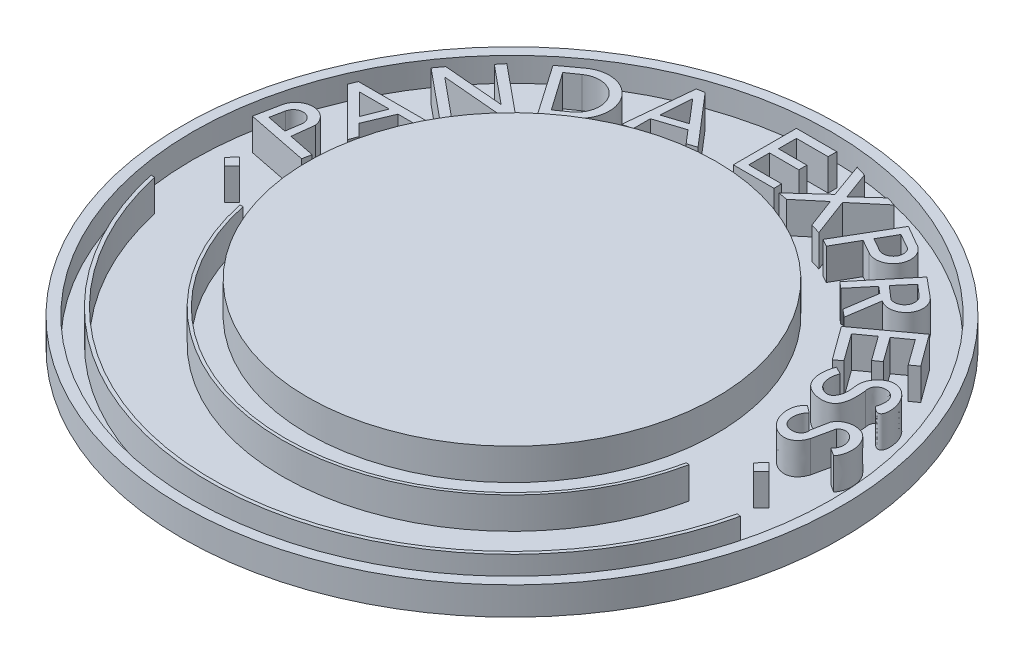
from build123d import *

# Parameters (mm, degrees)
SKETCH1_R           = 470.625097544
BOSS_EXTRUDE1_DEPTH = 40
CUT_EXTRUDE11_DEPTH = 25
SKETCH6_R           = 291.687541018
BOSS_EXTRUDE3_DEPTH = 45
SKETCH3_R           = 455.620261144
CUT_EXTRUDE2_DEPTH  = 34.62586797
BOSS_EXTRUDE2_DEPTH = 45


with BuildPart() as part:
    # Sketch1 → Boss-Extrude1 (new body)
    with BuildSketch(Plane(origin=(0, 0, 0), x_dir=(1, 0, 0), z_dir=(0, 1, 0))):
        with Locations(Location((0, 0, 0), (0, 0, 270))):
            Circle(SKETCH1_R)
    extrude(amount=BOSS_EXTRUDE1_DEPTH)

    # Sketch8 → Cut-Extrude11 (cut)
    with BuildSketch(Plane(origin=(0, 40, 0), x_dir=(1, 0, 0), z_dir=(0, 1, 0))):
        with BuildLine():
            add(Edge.make_bspline(
                [(-78.092140064, 180.367039615), (-37.088949883, 192.930885504), (-27.979018092, 201.559779116), (36.742104268, 189.950344156), (41.135480759, 188.522470723), (53.659176355, 176.974528823), (58.917918381, 200.465799047), (75.235401346, 202.388042437), (92.103608284, 205.785797647), (117.460180506, 198.945598189), (132.709036111, 176.253001871), (136.572625824, 156.407771568), (128.802366777, 146.149977736), (135.129652293, 141.98557315), (142.261858959, 135.998040445), (163.402615615, 120.484001713), (178.385442315, 104.071141637), (187.697573089, 89.753175202)],
                knots=[0, 0, 0, 0, 0.408914969, 0.446675587, 0.508431617, 0.521002502, 0.564664928, 0.590555136, 0.63116015, 0.681704712, 0.759020832, 0.80183971, 0.817986516, 0.824477412, 0.847950703, 0.884939571, 1, 1, 1, 1], degree=3))
            add(Edge.make_bspline(
                [(187.697573089, 89.753175202), (201.099130024, 73.635190326), (214.371449052, 50.800864957), (229.927138351, 14.906730736), (233.346226634, -14.610997758), (237.779523432, -62.132556941), (230.021359328, -113.77085296), (170.286447424, -178.51521243), (163.230608693, -160.639748503), (151.434876437, -167.474977403), (151.342019812, -178.571962074), (127.475859417, -198.76425843), (153.142307727, -183.331644513), (121.788929367, -210.174427182), (109.443412622, -220.52420196), (80.16913494, -238.437317437), (45.484749508, -248.630935843), (6.862212411, -248.824311869), (-22.397397864, -226.084987266), (-16.276789205, -198.970307853), (2.907216752, -185.543365873), (20.394455857, -162.508790923), (14.766760153, -129.91167007), (-9.057903263, -120.264817108), (-27.84229809, -121.325923382), (-43.839572583, -132.48302391), (-45.520267909, -149.212449948), (-42.975488553, -165.426003074), (-34.155582099, -180.192192277), (-29.338404778, -198.455273756), (-37.161950648, -221.93128079), (-65.658348891, -228.704413738), (-89.953472852, -220.668413177), (-113.371010565, -206.962502009), (-139.716682722, -183.576694746), (-165.108083304, -153.951184024), (-176.161908153, -114.864131918), (-181.578902965, -78.640106222), (-163.75479192, -28.540680127), (-155.343750009, -8.944260686), (-147.6978369, -6.159121549), (-153.056135591, 8.047048225), (-156.73138928, 20.821907596), (-161.72069507, 36.270128689), (-162.17356316, 58.570860299), (-159.86983732, 79.885300963), (-154.780606114, 97.632642929), (-146.298983101, 109.738709404), (-158.046013992, 118.438690999), (-167.19191405, 128.732794193), (-175.602670702, 147.605468296), (-180.147723304, 167.248312546), (-175.991101143, 186.387567042), (-164.002258877, 201.58320857), (-149.760259049, 211.877640928), (-133.73114126, 214.228102413), (-119.98120751, 215.656115447), (-98.803179263, 204.035068087), (-85.935357669, 190.941745077), (-78.092140064, 180.367039615)],
                knots=[0, 0, 0, 0, 0.000844039, 0.00106524, 0.001578705, 0.002025756, 0.003033238, 0.003439662, 0.005795513, 0.006183959, 0.006935679, 0.007485411, 0.011587306, 0.018429778, 0.025739133, 0.035794512, 0.04930888, 0.06245737, 0.073551933, 0.079975077, 0.086853545, 0.096500506, 0.107782102, 0.113287322, 0.120717281, 0.125951305, 0.131086713, 0.136401964, 0.142263494, 0.148033398, 0.154919652, 0.164335827, 0.173351472, 0.180326741, 0.191259015, 0.208518184, 0.218341553, 0.230862457, 0.247485129, 0.255896646, 0.314977619, 0.331296116, 0.360678818, 0.398702127, 0.435770802, 0.503678201, 0.532486314, 0.562211983, 0.575847682, 0.616946904, 0.653699089, 0.706744711, 0.744635728, 0.774818762, 0.830303046, 0.851583335, 0.87897372, 0.917276909, 1, 1, 1, 1], degree=3))
        make_face()
    extrude(amount=-CUT_EXTRUDE11_DEPTH, mode=Mode.SUBTRACT)

    # Sketch6 → Boss-Extrude3 (add)
    with BuildSketch(Plane(origin=(0, 40, 0), x_dir=(1, 0, 0), z_dir=(0, 1, 0))):
        with Locations(Location((0, 0, 0), (0, 0, 90))):
            Circle(SKETCH6_R)
    extrude(amount=BOSS_EXTRUDE3_DEPTH)

    # Sketch3 → Cut-Extrude2 (cut)
    with BuildSketch(Plane(origin=(0, 40, 0), x_dir=(1, 0, 0), z_dir=(0, 1, 0))):
        with Locations(Location((0, 0, 0), (0, 0, 270))):
            Circle(SKETCH3_R)
    extrude(amount=-CUT_EXTRUDE2_DEPTH, mode=Mode.SUBTRACT)


with BuildPart() as cut_extrude2_piece_1:
    # of the separate pieces the step leaves, piece 1, a body of its own (cut_extrude2_pieces)
    add(part.part.solids().sort_by_distance((0, 40, -291.687541018))[0])


with BuildPart() as cut_extrude2_piece_2:
    # of the separate pieces the step leaves, piece 2, a body of its own (cut_extrude2_pieces)
    add(part.part.solids().sort_by_distance((0, 0, 470.625097544))[0])

    # Sketch4 → Boss-Extrude2 (add)
    # profile 1 of 16: a face of its own
    with BuildSketch(Plane(origin=(0, 5.37413203, 0), x_dir=(1, 0, 0), z_dir=(0, 1, 0))):
        Polygon((364.46284673, -19.84101692), (375.298774156, -8.52005088), (386.377220889, -19.598497614), (375.298774156, -30.676944347), align=None)
    # profile 2 of 16: a face of its own
    with BuildSketch(Plane(origin=(0, 5.37413203, 0), x_dir=(1, 0, 0), z_dir=(0, 1, 0))):
        with BuildLine():
            Line((-321.07332375, -67.355183159), (-316.727724187, -67.355183159))
            ThreePointArc((-316.727724187, -67.355183159), (0, -323.810395088), (316.727724187, -67.355183159))
            Line((316.727724187, -67.355183159), (320.886519161, -68.23959073))
            ThreePointArc((320.886519161, -68.23959073), (-0.45196037, -328.061877782), (-321.07332375, -67.355183159))
        make_face()
    # profile 3 of 16: a face of its own
    with BuildSketch(Plane(origin=(0, 5.37413203, 0), x_dir=(1, 0, 0), z_dir=(0, 1, 0))):
        with BuildLine():
            Line((416.227536422, -94.099439286), (421.202079266, -95.224068609))
            ThreePointArc((421.202079266, -95.224068609), (-0.576332378, -431.831544311), (-421.454754804, -94.099439286))
            Line((-421.454754804, -94.099439286), (-416.227536422, -94.099439286))
            ThreePointArc((-416.227536422, -94.099439286), (0, -426.731843844), (416.227536422, -94.099439286))
        make_face()
    # profile 4 of 16: a face of its own
    with BuildSketch(Plane(origin=(0, 5.37413203, 0), x_dir=(1, 0, 0), z_dir=(0, 1, 0))):
        with BuildLine():
            Line((401.417594673, 53.805674327), (413.103498964, 46.252744817))
            add(Edge.make_bspline(
                [(369.192828292, 85.210608043), (372.507703433, 92.739903712), (385.734880489, 100.135409316), (419.151518146, 94.177927522), (423.99688382, 59.67217761), (413.103498964, 46.252744817)],
                knots=[0, 0, 0, 0, 0.250574055, 0.443565275, 1, 1, 1, 1], degree=3))
            Line((369.192828292, 85.210608043), (364.46284673, 61.543278313))
            add(Edge.make_bspline(
                [(342.937591476, 81.4837119), (334.281350302, 75.395136283), (331.75139394, 41.827476902), (366.943374028, 47.040768514), (364.46284673, 61.543278313)],
                knots=[0, 0, 0, 0, 0.511771913, 1, 1, 1, 1], degree=3))
            Line((342.937591476, 81.4837119), (332.139568512, 89.753175202))
            add(Edge.make_bspline(
                [(332.139568512, 89.753175202), (319.951039406, 80.132186398), (323.353695305, 34.868950379), (367.290114743, 26.278585323), (375.298774156, 51.194303697)],
                knots=[0, 0, 0, 0, 0.459951469, 1, 1, 1, 1], degree=3))
            Line((375.298774156, 51.194303697), (381.910198575, 81.4837119))
            add(Edge.make_bspline(
                [(401.417594673, 53.805674327), (407.813665599, 58.67553153), (410.186729671, 78.278695648), (390.589542215, 90.386805381), (381.910198575, 81.4837119)],
                knots=[0, 0, 0, 0, 0.438729849, 1, 1, 1, 1], degree=3))
        make_face()
    # profile 5 of 16: a face of its own
    with BuildSketch(Plane(origin=(0, 5.37413203, 0), x_dir=(1, 0, 0), z_dir=(0, 1, 0))):
        with BuildLine():
            Line((305.532462516, 157.939250384), (316.491893802, 152.178907711))
            add(Edge.make_bspline(
                [(316.491893802, 152.178907711), (312.341383114, 142.769908485), (313.252459519, 122.725029525), (336.771460182, 115.4010574), (347.114905436, 135.165474652), (336.947676231, 157.728398221), (363.762646489, 188.170371347), (403.075350403, 163.870198528), (398.594568684, 119.589161451), (381.910198575, 137.216210342)],
                knots=[0, 0, 0, 0, 0.168105409, 0.236644245, 0.306997887, 0.450025045, 0.594025801, 0.792720453, 1, 1, 1, 1], degree=3))
            add(Edge.make_bspline(
                [(355.464500901, 149.395150061), (352.074205994, 163.176346162), (370.422142891, 169.956145396), (385.93965957, 155.405708664), (383.967523737, 143.329850159), (381.910198575, 137.216210342)],
                knots=[0, 0, 0, 0, 0.494708933, 0.645783631, 1, 1, 1, 1], degree=3))
            add(Edge.make_bspline(
                [(355.464500901, 149.395150061), (356.691076667, 137.605067508), (359.015513992, 100.665387814), (298.524412727, 110.129056114), (300.652881804, 145.047583234), (305.532462516, 157.939250384)],
                knots=[0, 0, 0, 0, 0.323017416, 0.634298948, 1, 1, 1, 1], degree=3))
        make_face()
    # profile 6 of 16: a face of its own
    with BuildSketch(Plane(origin=(0, 5.37413203, 0), x_dir=(1, 0, 0), z_dir=(0, 1, 0))):
        Polygon((297.21863654, 225.860771419), (274.990190867, 209.806893989), (302.991203142, 171.036261609), (293.346751992, 164.070824668), (258.626253305, 211.751582671), (331.134349281, 264.805135766), (364.46284673, 219.255200828), (354.073221588, 211.751582671), (327.88665964, 248.009899214), (307.033649341, 232.949391776), (332.139568512, 198.187349847), (322.32455571, 191.098729491), align=None)
    # profile 7 of 16: a face of its own
    with BuildSketch(Plane(origin=(0, 5.37413203, 0), x_dir=(1, 0, 0), z_dir=(0, 1, 0))):
        with BuildLine():
            Line((202.176240627, 265.937606052), (211.161918341, 258.474481149))
            Line((211.161918341, 258.474481149), (235.634707701, 287.939966561))
            Line((235.634707701, 287.939966561), (245.328845327, 279.888424738))
            Line((245.328845327, 279.888424738), (238.420184117, 234.11125611))
            Line((238.420184117, 234.11125611), (249.221559704, 225.140089138))
            Line((249.221559704, 225.140089138), (256.352125368, 272.387608873))
            ThreePointArc((256.352125368, 272.387608873), (289.820423166, 277.494923719), (286.036125628, 311.138507276))
            Line((286.036125628, 311.138507276), (258.626253305, 333.903991108))
            Line((258.626253305, 333.903991108), (202.176240627, 265.937606052))
        make_face()
        with BuildLine():
            Line((261.121923572, 318.307489691), (276.353493459, 305.139551853))
            ThreePointArc((276.353493459, 305.139551853), (279.188456139, 286.121197869), (260.812262681, 280.459898046))
            Line((260.812262681, 280.459898046), (242.264470214, 296.494763792))
            Line((242.264470214, 296.494763792), (261.121923572, 318.307489691))
        make_face(mode=Mode.SUBTRACT)
    # profile 8 of 16: a face of its own
    with BuildSketch(Plane(origin=(0, 5.37413203, 0), x_dir=(1, 0, 0), z_dir=(0, 1, 0))):
        with BuildLine():
            Line((182.809686744, 383.31970118), (209.971717742, 367.502256463))
            ThreePointArc((209.971717742, 367.502256463), (222.844995869, 333.072142019), (187.697573089, 322.31050914))
            Line((187.697573089, 322.31050914), (167.716786244, 333.714067651))
            Line((167.716786244, 333.714067651), (148.629692393, 300.270546196))
            Line((148.629692393, 300.270546196), (137.901066259, 306.201723942))
            Line((137.901066259, 306.201723942), (182.809686744, 383.31970118))
        make_face()
        with BuildLine():
            Line((187.489325523, 367.976334173), (209.906759578, 355.182117263))
            ThreePointArc((209.906759578, 355.182117263), (209.84111925, 336.485930989), (191.435883355, 333.199750612))
            Line((191.435883355, 333.199750612), (173.487663136, 343.4432701))
            Line((173.487663136, 343.4432701), (187.489325523, 367.976334173))
        make_face(mode=Mode.SUBTRACT)
    # profile 9 of 16: a face of its own
    with BuildSketch(Plane(origin=(0, 5.37413203, 0), x_dir=(1, 0, 0), z_dir=(0, 1, 0))):
        Polygon((73.015350112, 419.970314892), (87.855432685, 415.404135639), (102.327477248, 376.005875047), (132.756195339, 403.768596672), (146.143992391, 399.649274502), (106.120149696, 365.937193731), (126.586214053, 311.665790624), (112.2083887, 316.089736886), (96.271396822, 358.351057651), (62.360931855, 329.788274645), (48.795004389, 332.174755468), (90.786688868, 370.487360136), align=None)
    # profile 10 of 16: a face of its own
    with BuildSketch(Plane(origin=(0, 5.37413203, 0), x_dir=(1, 0, 0), z_dir=(0, 1, 0))):
        Polygon((-18.387423245, 424.552997317), (-18.387423245, 334.424969551), (39.704575695, 334.424969551), (39.704575695, 345.379887942), (-7.281599919, 345.379887942), (-7.281599919, 375.003939398), (34.578811082, 375.003939398), (34.578811082, 386.536909776), (-6.000158765, 386.536909776), (-6.000158765, 412.165732838), (39.277428643, 412.165732838), (39.277428643, 424.552997317), align=None)
    # profile 11 of 16: a face of its own
    with BuildSketch(Plane(origin=(0, 5.37413203, 0), x_dir=(1, 0, 0), z_dir=(0, 1, 0))):
        Polygon((-78.092140064, 326.788508605), (-65.29475031, 330.956465819), (-127.938103047, 403.768596672), (-138.679900646, 401.872444068), (-148.209533622, 304.462576052), (-134.632425585, 307.996343897), (-134.632425585, 332.174755468), (-94.087089258, 345.379887942), align=None)
        Polygon((-129.32192134, 387.388856315), (-100.688071465, 353.905725412), (-132.272173547, 343.619160055), align=None, mode=Mode.SUBTRACT)
    # profile 12 of 16: a face of its own
    with BuildSketch(Plane(origin=(0, 5.37413203, 0), x_dir=(1, 0, 0), z_dir=(0, 1, 0))):
        with BuildLine():
            Line((-270.213042123, 328.739113585), (-243.762787584, 348.113935765))
            ThreePointArc((-243.762787584, 348.113935765), (-181.009309699, 337.230894229), (-194.209513559, 274.923637848))
            Line((-194.209513559, 274.923637848), (-219.781624151, 255.8859376))
            Line((-219.781624151, 255.8859376), (-270.213042123, 328.739113585))
        make_face()
        with BuildLine():
            Line((-254.341086669, 326.788508605), (-238.187291474, 338.124505233))
            ThreePointArc((-238.187291474, 338.124505233), (-192.033211664, 330.205087202), (-199.623443374, 283.995730492))
            Line((-199.623443374, 283.995730492), (-216.165016681, 272.387608873))
            Line((-216.165016681, 272.387608873), (-254.341086669, 326.788508605))
        make_face(mode=Mode.SUBTRACT)
    # profile 13 of 16: a face of its own
    with BuildSketch(Plane(origin=(0, 5.37413203, 0), x_dir=(1, 0, 0), z_dir=(0, 1, 0))):
        Polygon((-305.13774128, 297.816030899), (-313.231692571, 287.978767022), (-258.761451842, 243.161480346), (-345.087191396, 250.574779462), (-354.044349365, 238.450690657), (-285.047860018, 181.681427271), (-277.2994468, 191.098729491), (-332.976035761, 236.908581168), (-245.769575969, 229.419649424), (-236.178049078, 241.077043644), align=None)
    # profile 14 of 16: a face of its own
    with BuildSketch(Plane(origin=(0, 5.37413203, 0), x_dir=(1, 0, 0), z_dir=(0, 1, 0))):
        Polygon((-388.929126795, 169.709118075), (-393.666235365, 158.455186048), (-324.964224519, 89.753175202), (-320.482952396, 102.20115332), (-336.904145721, 118.622346645), (-320.482952396, 157.634117382), (-297.892374984, 157.634117382), (-292.80965464, 169.709118075), align=None)
        Polygon((-375.512716273, 157.634117382), (-345.087191396, 127.208592505), (-332.976035761, 157.634117382), align=None, mode=Mode.SUBTRACT)
    # profile 15 of 16: a face of its own
    with BuildSketch(Plane(origin=(0, 5.37413203, 0), x_dir=(1, 0, 0), z_dir=(0, 1, 0))):
        Polygon((-390.967379935, -19.644672313), (-380.313217869, -8.52005088), (-369.42382612, -19.40944263), (-380.313217869, -30.298834379), align=None)
    # profile 16 of 16: a face of its own
    with BuildSketch(Plane(origin=(0, 5.37413203, 0), x_dir=(1, 0, 0), z_dir=(0, 1, 0))):
        with BuildLine():
            Line((-369.42382612, 53.805674327), (-365.772941929, 85.210608043))
            ThreePointArc((-365.772941929, 85.210608043), (-389.847203107, 106.422517788), (-414.900184793, 86.375990035))
            Line((-414.900184793, 86.375990035), (-421.93652206, 51.194303697))
            Line((-421.93652206, 51.194303697), (-334.181084304, 33.643216145))
            Line((-334.181084304, 33.643216145), (-331.65917857, 46.252744817))
            Line((-331.65917857, 46.252744817), (-369.42382612, 53.805674327))
        make_face()
        with BuildLine():
            Line((-408.666134737, 61.543278313), (-404.70226562, 81.362623894))
            ThreePointArc((-404.70226562, 81.362623894), (-389.17371518, 92.5072174), (-376.985211119, 77.783827439))
            Line((-376.985211119, 77.783827439), (-380.313217869, 55.87269494))
            Line((-380.313217869, 55.87269494), (-408.666134737, 61.543278313))
        make_face(mode=Mode.SUBTRACT)
    extrude(amount=BOSS_EXTRUDE2_DEPTH)


solid = Compound([cut_extrude2_piece_1.part, cut_extrude2_piece_2.part])
